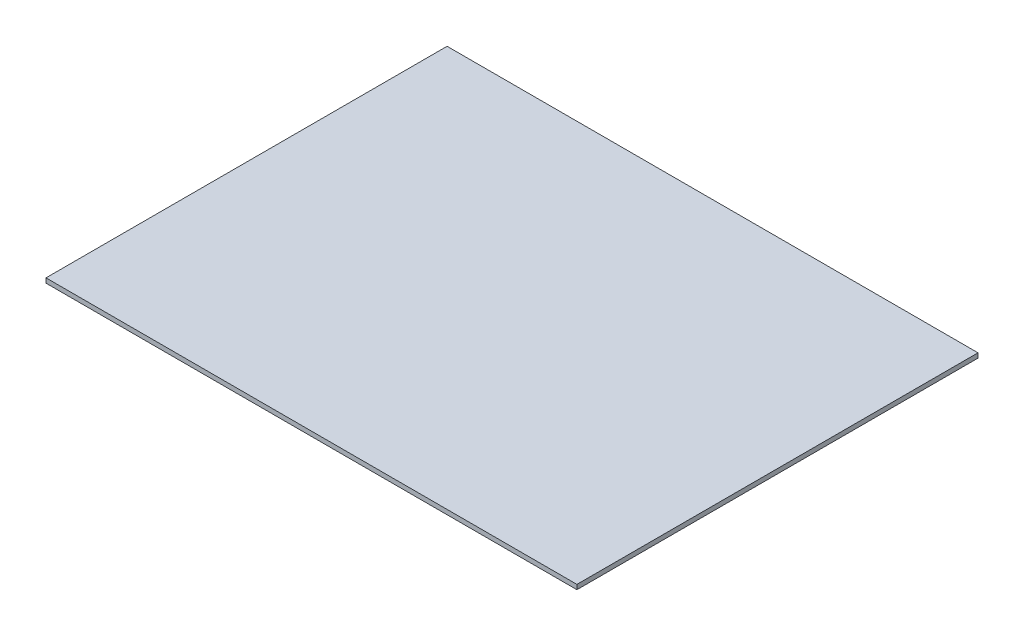
from build123d import *

# Parameters (mm, degrees)
SKETCH1_W           = 229
SKETCH1_H           = 173
BOSS_EXTRUDE1_DEPTH = 2


with BuildPart() as part:
    # Sketch1 → Boss-Extrude1 (new body)
    with BuildSketch(Plane(origin=(0, 0, 0), x_dir=(1, 0, 0), z_dir=(0, 1, 0))):
        with Locations((114.5, 86.5)):
            Rectangle(SKETCH1_W, SKETCH1_H)
    extrude(amount=BOSS_EXTRUDE1_DEPTH)


solid = part.part
